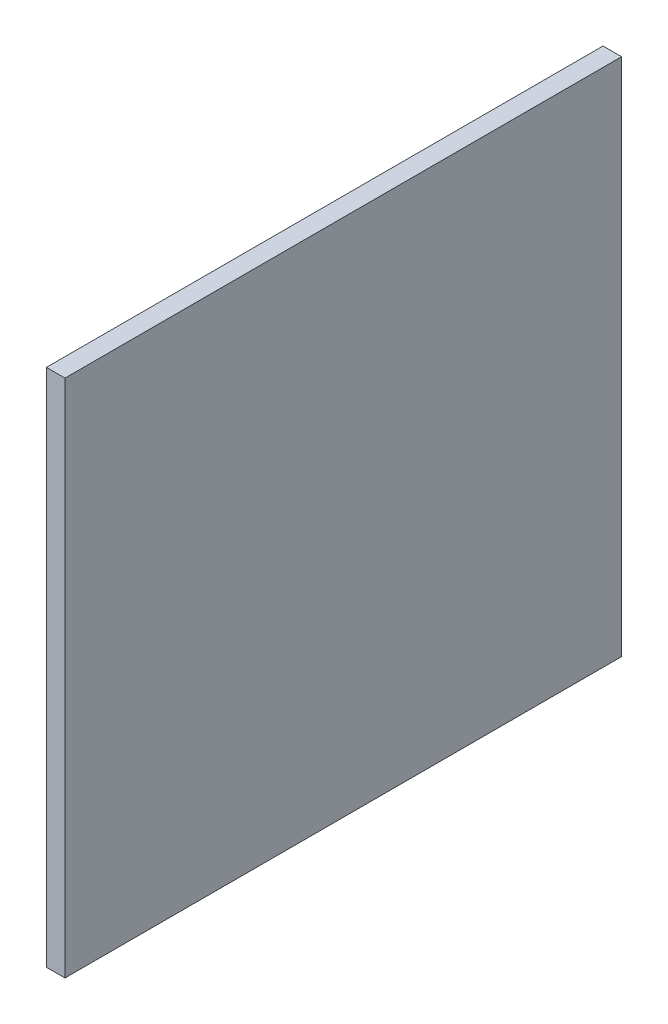
from build123d import *

# Parameters (mm, degrees)
SKETCH1_W           = 750
SKETCH1_H           = 700
BOSS_EXTRUDE1_DEPTH = 25


with BuildPart() as part:
    # Sketch1 → Boss-Extrude1 (new body)
    with BuildSketch(Plane(origin=(0, 0, 0), x_dir=(0, 0, -1), z_dir=(1, 0, 0))):
        with Locations((375, 350)):
            Rectangle(SKETCH1_W, SKETCH1_H)
    extrude(amount=BOSS_EXTRUDE1_DEPTH)


solid = part.part
